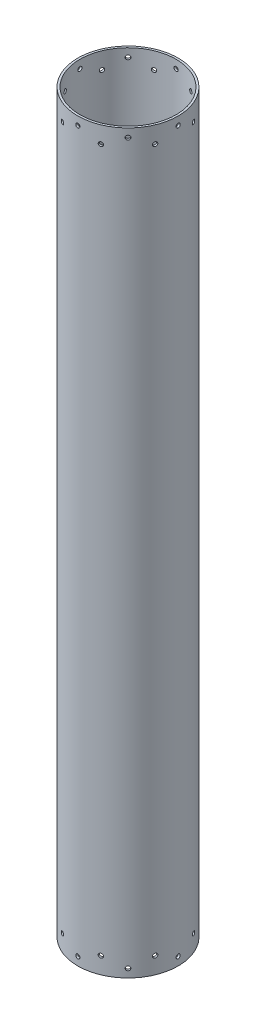
from build123d import *

# Parameters (mm, degrees)
SKETCH2_R                = 76.2
SKETCH2_R_2              = 73.025
BOSS_EXTRUDE1_DEPTH      = 1117.6
SKETCH3_R                = 3.175
CUT_EXTRUDE1_DEPTH       = 1143
CIRPATTERN1_COUNT        = 8
SKETCH6_R                = 3.175
CUT_EXTRUDE2_DEPTH       = 25.4
CIRPATTERN2_COUNT        = 8
MIRROR1_COPY_1_SKETCH_R  = 3.175
MIRROR1_COPY_1_DEPTH     = 1143
MIRROR1_COPY_2_SKETCH_R  = 3.175
MIRROR1_COPY_2_DEPTH     = 1143
MIRROR1_COPY_3_SKETCH_R  = 3.175
MIRROR1_COPY_3_DEPTH     = 1143
MIRROR1_COPY_4_SKETCH_R  = 3.175
MIRROR1_COPY_4_DEPTH     = 1143
MIRROR1_COPY_5_SKETCH_R  = 3.175
MIRROR1_COPY_5_DEPTH     = 1143
MIRROR1_COPY_6_SKETCH_R  = 3.175
MIRROR1_COPY_6_DEPTH     = 1143
MIRROR1_COPY_7_SKETCH_R  = 3.175
MIRROR1_COPY_7_DEPTH     = 1143
MIRROR1_COPY_8_SKETCH_R  = 3.175
MIRROR1_COPY_8_DEPTH     = 25.4
MIRROR1_COPY_9_SKETCH_R  = 3.175
MIRROR1_COPY_9_DEPTH     = 25.4
MIRROR1_COPY_10_SKETCH_R = 3.175
MIRROR1_COPY_10_DEPTH    = 25.4
MIRROR1_COPY_11_SKETCH_R = 3.175
MIRROR1_COPY_11_DEPTH    = 25.4
MIRROR1_COPY_12_SKETCH_R = 3.175
MIRROR1_COPY_12_DEPTH    = 25.4
MIRROR1_COPY_13_SKETCH_R = 3.175
MIRROR1_COPY_13_DEPTH    = 25.4
MIRROR1_COPY_14_SKETCH_R = 3.175
MIRROR1_COPY_14_DEPTH    = 25.4


with BuildPart() as part:
    # Sketch2 → Boss-Extrude1 (new body)
    with BuildSketch(Plane(origin=(0, 0, 0), x_dir=(1, 0, 0), z_dir=(0, 1, 0))):
        with Locations(Location((0, 0, 0), (0, 0, 270))):
            Circle(SKETCH2_R)
        with Locations(Location((0, 0, 0), (0, 0, 270))):
            Circle(SKETCH2_R_2, mode=Mode.SUBTRACT)
    extrude(amount=BOSS_EXTRUDE1_DEPTH)

    # Sketch3 → Cut-Extrude1 (cut)
    with BuildSketch(Plane.XY):
        with Locations(Location((0, 1104.9, 0), (0, 0, 90))):
            Circle(SKETCH3_R)
    cut_extrude1 = extrude(amount=-CUT_EXTRUDE1_DEPTH, mode=Mode.SUBTRACT)

    # CirPattern1: Cut-Extrude1 ×8 about axis
    cirpattern1_axis = Axis((0, 1117.6, 0), (0, -1, 0))
    for i in range(1, CIRPATTERN1_COUNT):
        add(cut_extrude1.rotate(cirpattern1_axis, i * 360 / CIRPATTERN1_COUNT), mode=Mode.SUBTRACT)

    # Sketch6 → Cut-Extrude2 (cut)
    with BuildSketch(Plane(origin=(-29.160477546, 0, 70.399620377), x_dir=(0, -1, 0), z_dir=(-0.3826834323650906, 0, 0.9238795325112865))):
        with Locations(Location((-1092.2, 0, 0), (0, 0, 90))):
            Circle(SKETCH6_R)
    cut_extrude2 = extrude(amount=-CUT_EXTRUDE2_DEPTH, mode=Mode.SUBTRACT)

    # CirPattern2: Cut-Extrude2 ×8 about axis
    cirpattern2_axis = Axis((0, 1117.6, 0), (0, -1, 0))
    for i in range(1, CIRPATTERN2_COUNT):
        add(cut_extrude2.rotate(cirpattern2_axis, i * 360 / CIRPATTERN2_COUNT), mode=Mode.SUBTRACT)

    # Mirror1: Cut-Extrude1, Cut-Extrude2 across plane
    add(cut_extrude1.mirror(Plane.ZX.offset(558.8)), mode=Mode.SUBTRACT)
    add(cut_extrude2.mirror(Plane.ZX.offset(558.8)), mode=Mode.SUBTRACT)

    # Mirror1 copy 1 sketch → Mirror1 copy 1 (cut)
    with BuildSketch(Plane(origin=(0, 1117.6, 0), x_dir=(0.7071067811865476, 0, 0.7071067811865475), z_dir=(-0.7071067811865475, 0, 0.7071067811865476))):
        with Locations((0, -1104.9)):
            Circle(MIRROR1_COPY_1_SKETCH_R)
    extrude(amount=-MIRROR1_COPY_1_DEPTH, mode=Mode.SUBTRACT)

    # Mirror1 copy 2 sketch → Mirror1 copy 2 (cut)
    with BuildSketch(Plane(origin=(0, 1117.6, 0), x_dir=(0, 0, 1), z_dir=(-1, 0, 0))):
        with Locations((0, -1104.9)):
            Circle(MIRROR1_COPY_2_SKETCH_R)
    extrude(amount=-MIRROR1_COPY_2_DEPTH, mode=Mode.SUBTRACT)

    # Mirror1 copy 3 sketch → Mirror1 copy 3 (cut)
    with BuildSketch(Plane(origin=(0, 1117.6, 0), x_dir=(-0.7071067811865475, 0, 0.7071067811865476), z_dir=(-0.7071067811865476, 0, -0.7071067811865475))):
        with Locations((0, -1104.9)):
            Circle(MIRROR1_COPY_3_SKETCH_R)
    extrude(amount=-MIRROR1_COPY_3_DEPTH, mode=Mode.SUBTRACT)

    # Mirror1 copy 4 sketch → Mirror1 copy 4 (cut)
    with BuildSketch(Plane(origin=(0, 1117.6, 0), x_dir=(-1, 0, 0), z_dir=(0, 0, -1))):
        with Locations((0, -1104.9)):
            Circle(MIRROR1_COPY_4_SKETCH_R)
    extrude(amount=-MIRROR1_COPY_4_DEPTH, mode=Mode.SUBTRACT)

    # Mirror1 copy 5 sketch → Mirror1 copy 5 (cut)
    with BuildSketch(Plane(origin=(0, 1117.6, 0), x_dir=(-0.7071067811865477, 0, -0.7071067811865475), z_dir=(0.7071067811865475, 0, -0.7071067811865477))):
        with Locations((0, -1104.9)):
            Circle(MIRROR1_COPY_5_SKETCH_R)
    extrude(amount=-MIRROR1_COPY_5_DEPTH, mode=Mode.SUBTRACT)

    # Mirror1 copy 6 sketch → Mirror1 copy 6 (cut)
    with BuildSketch(Plane(origin=(0, 1117.6, 0), x_dir=(0, 0, -1), z_dir=(1, 0, 0))):
        with Locations((0, -1104.9)):
            Circle(MIRROR1_COPY_6_SKETCH_R)
    extrude(amount=-MIRROR1_COPY_6_DEPTH, mode=Mode.SUBTRACT)

    # Mirror1 copy 7 sketch → Mirror1 copy 7 (cut)
    with BuildSketch(Plane(origin=(0, 1117.6, 0), x_dir=(0.7071067811865474, 0, -0.7071067811865477), z_dir=(0.7071067811865477, 0, 0.7071067811865474))):
        with Locations((0, -1104.9)):
            Circle(MIRROR1_COPY_7_SKETCH_R)
    extrude(amount=-MIRROR1_COPY_7_DEPTH, mode=Mode.SUBTRACT)

    # Mirror1 copy 8 sketch → Mirror1 copy 8 (cut)
    with BuildSketch(Plane(origin=(-70.399620377, 1117.6, 29.160477546), x_dir=(0, 1, 0), z_dir=(-0.9238795325112872, 0, 0.3826834323650891))):
        with Locations((-1092.2, 0)):
            Circle(MIRROR1_COPY_8_SKETCH_R)
    extrude(amount=-MIRROR1_COPY_8_DEPTH, mode=Mode.SUBTRACT)

    # Mirror1 copy 9 sketch → Mirror1 copy 9 (cut)
    with BuildSketch(Plane(origin=(-70.399620377, 1117.6, -29.160477546), x_dir=(0, 1, 0), z_dir=(-0.9238795325112865, 0, -0.38268343236509056))):
        with Locations((-1092.2, 0)):
            Circle(MIRROR1_COPY_9_SKETCH_R)
    extrude(amount=-MIRROR1_COPY_9_DEPTH, mode=Mode.SUBTRACT)

    # Mirror1 copy 10 sketch → Mirror1 copy 10 (cut)
    with BuildSketch(Plane(origin=(-29.160477546, 1117.6, -70.399620377), x_dir=(0, 1, 0), z_dir=(-0.3826834323650891, 0, -0.9238795325112872))):
        with Locations((-1092.2, 0)):
            Circle(MIRROR1_COPY_10_SKETCH_R)
    extrude(amount=-MIRROR1_COPY_10_DEPTH, mode=Mode.SUBTRACT)

    # Mirror1 copy 11 sketch → Mirror1 copy 11 (cut)
    with BuildSketch(Plane(origin=(29.160477546, 1117.6, -70.399620377), x_dir=(0, 1, 0), z_dir=(0.3826834323650905, 0, -0.9238795325112865))):
        with Locations((-1092.2, 0)):
            Circle(MIRROR1_COPY_11_SKETCH_R)
    extrude(amount=-MIRROR1_COPY_11_DEPTH, mode=Mode.SUBTRACT)

    # Mirror1 copy 12 sketch → Mirror1 copy 12 (cut)
    with BuildSketch(Plane(origin=(70.399620377, 1117.6, -29.160477546), x_dir=(0, 1, 0), z_dir=(0.9238795325112872, 0, -0.3826834323650892))):
        with Locations((-1092.2, 0)):
            Circle(MIRROR1_COPY_12_SKETCH_R)
    extrude(amount=-MIRROR1_COPY_12_DEPTH, mode=Mode.SUBTRACT)

    # Mirror1 copy 13 sketch → Mirror1 copy 13 (cut)
    with BuildSketch(Plane(origin=(70.399620377, 1117.6, 29.160477546), x_dir=(0, 1, 0), z_dir=(0.9238795325112866, 0, 0.38268343236509045))):
        with Locations((-1092.2, 0)):
            Circle(MIRROR1_COPY_13_SKETCH_R)
    extrude(amount=-MIRROR1_COPY_13_DEPTH, mode=Mode.SUBTRACT)

    # Mirror1 copy 14 sketch → Mirror1 copy 14 (cut)
    with BuildSketch(Plane(origin=(29.160477546, 1117.6, 70.399620377), x_dir=(0, 1, 0), z_dir=(0.3826834323650893, 0, 0.9238795325112872))):
        with Locations((-1092.2, 0)):
            Circle(MIRROR1_COPY_14_SKETCH_R)
    extrude(amount=-MIRROR1_COPY_14_DEPTH, mode=Mode.SUBTRACT)


solid = part.part
